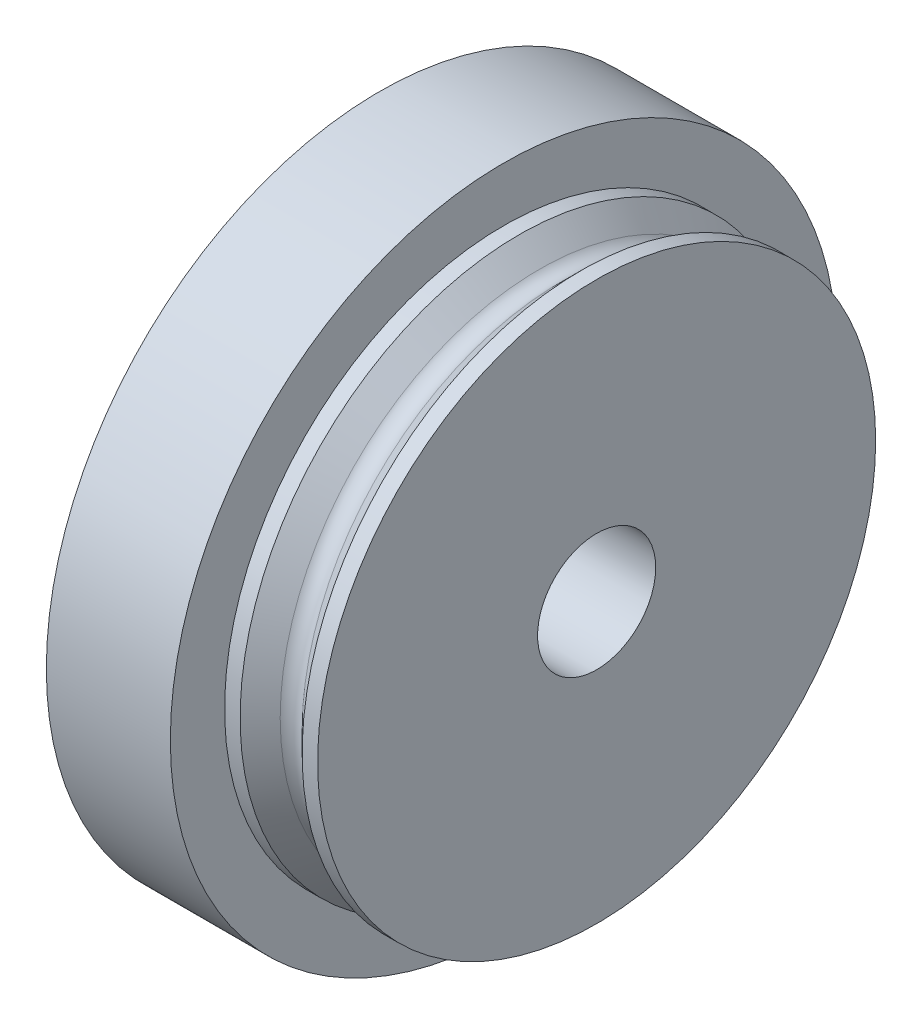
from build123d import *

# Parameters (mm, degrees)
SKETCH3_R           = 21.5
SKETCH3_R_2         = 7.81
BOSS_EXTRUDE1_DEPTH = 8


with BuildPart() as part:
    # Sketch1 → Revolve1 (revolve)
    with BuildSketch(Plane.XY, mode=Mode.PRIVATE) as revolve1_sk:
        Polygon((0, 3.81), (-14, 3.81), (-14, 7.81), (-6, 7.81), (-6, 18), (0, 18), align=None)
    revolve(revolve1_sk.sketch.rotate(Axis((0, 0, 0), (-1, 0, 0)), 90), axis=Axis((0, 0, 0), (-1, 0, 0)))

    # Sketch2 → Cut-Revolve1 (revolve, cut)
    with BuildSketch(Plane(origin=(0, 0, 0), x_dir=(1, 0, 0), z_dir=(0, 1, 0))):
        with BuildLine():
            Line((-5, 18), (-3.707106781, 16.707106781))
            ThreePointArc((-3.707106781, 16.707106781), (-3, 16.414213562), (-2.292893219, 16.707106781))
            Line((-2.292893219, 16.707106781), (-1, 18))
            Line((-1, 18), (-5, 18))
        make_face()
    revolve(axis=Axis((0, 0, 0), (-1, 0, 0)), mode=Mode.SUBTRACT)


with BuildPart() as body_2:
    # Sketch3 → Boss-Extrude1 (new body)
    with BuildSketch(Plane.ZY.offset(6)):
        Circle(SKETCH3_R)
        Circle(SKETCH3_R_2, mode=Mode.SUBTRACT)
    extrude(amount=BOSS_EXTRUDE1_DEPTH)


solid = Compound([part.part, body_2.part])
